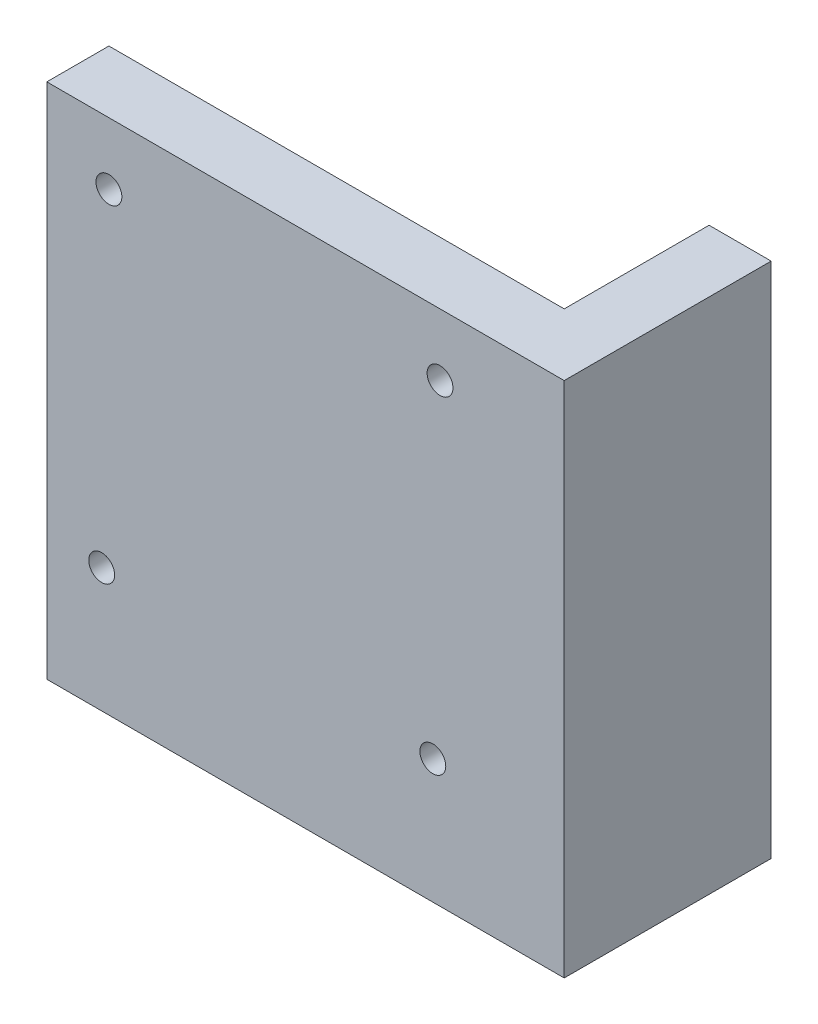
from build123d import *

# Parameters (mm, degrees)
SKETCH1_W           = 50
SKETCH1_H           = 20
BOSS_EXTRUDE1_DEPTH = 6
SKETCH2_W           = 6
SKETCH2_H           = 20
BOSS_EXTRUDE2_DEPTH = 44
SKETCH3_W           = 44
SKETCH3_H           = 6
BOSS_EXTRUDE3_DEPTH = 44
SKETCH5_R           = 1.25
CUT_EXTRUDE1_DEPTH  = 74.484692283


with BuildPart() as part:
    # Sketch1 → Boss-Extrude1 (new body)
    with BuildSketch(Plane(origin=(0, 0, 0), x_dir=(1, 0, 0), z_dir=(0, 1, 0))):
        with Locations((25, 10)):
            Rectangle(SKETCH1_W, SKETCH1_H)
    extrude(amount=BOSS_EXTRUDE1_DEPTH)

    # Sketch2 → Boss-Extrude2 (add)
    with BuildSketch(Plane(origin=(0, 6, 0), x_dir=(1, 0, 0), z_dir=(0, 1, 0))):
        with Locations((47, 10)):
            Rectangle(SKETCH2_W, SKETCH2_H)
    extrude(amount=BOSS_EXTRUDE2_DEPTH)

    # Sketch3 → Boss-Extrude3 (add)
    with BuildSketch(Plane(origin=(0, 6, 0), x_dir=(1, 0, 0), z_dir=(0, 1, 0))):
        with Locations((22, 3)):
            Rectangle(SKETCH3_W, SKETCH3_H)
    extrude(amount=BOSS_EXTRUDE3_DEPTH)

    # Sketch5 → Cut-Extrude1 (cut, through all)
    with BuildSketch(Plane.XY):
        with Locations((6, 44)):
            Circle(SKETCH5_R)
        with Locations((38, 44)):
            Circle(SKETCH5_R)
        with Locations((5.302448234, 12)):
            Circle(SKETCH5_R)
        with Locations((37.302448234, 12)):
            Circle(SKETCH5_R)
    extrude(amount=-CUT_EXTRUDE1_DEPTH, mode=Mode.SUBTRACT)


solid = part.part
